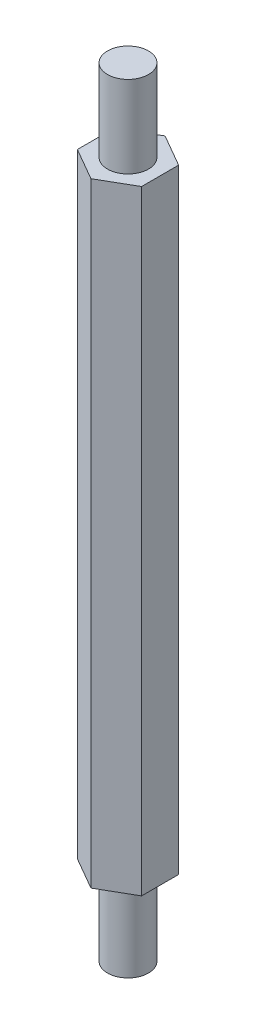
from build123d import *

# Parameters (mm, degrees)
BOSS_EXTRUDE1_DEPTH = 45
SKETCH2_R           = 1.5
BOSS_EXTRUDE2_DEPTH = 6
BOSS_EXTRUDE3_START = 6
SKETCH5_R           = 1.5
BOSS_EXTRUDE3_DEPTH = 6


with BuildPart() as part:
    # Sketch1 → Boss-Extrude1 (new body)
    with BuildSketch(Plane(origin=(0, 0, 0), x_dir=(1, 0, 0), z_dir=(0, 1, 0))):
        Polygon((0, 2.713546265), (-2.35, 1.356773133), (-2.35, -1.356773133), (0, -2.713546265), (2.35, -1.356773133), (2.35, 1.356773133), align=None)
    extrude(amount=BOSS_EXTRUDE1_DEPTH)

    # Sketch2 → Boss-Extrude2 (add)
    with BuildSketch(Plane(origin=(0, 45, 0), x_dir=(1, 0, 0), z_dir=(0, 1, 0))):
        with Locations(Location((0, 0, 0), (0, 0, 270))):
            Circle(SKETCH2_R)
    extrude(amount=BOSS_EXTRUDE2_DEPTH)

    # Sketch5 → Boss-Extrude3 (add)
    with BuildSketch(Plane.XZ.offset(BOSS_EXTRUDE3_START)):
        with Locations(Location((0, 0, 0), (0, 0, 90))):
            Circle(SKETCH5_R)
    extrude(amount=-BOSS_EXTRUDE3_DEPTH)


solid = part.part
